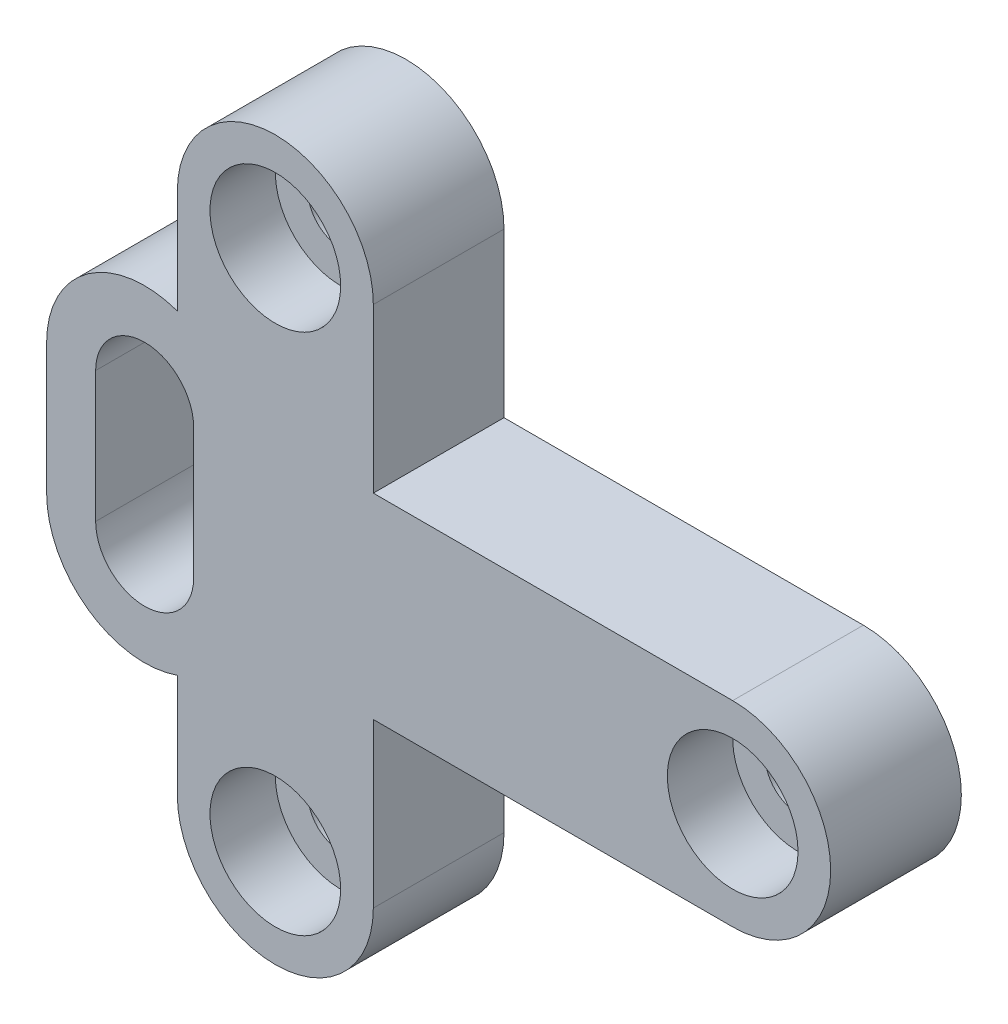
from build123d import *

# Parameters (mm, degrees)
SKETCH1_R           = 5
BOSS_EXTRUDE1_DEPTH = 20
SKETCH2_R           = 10
CUT_EXTRUDE1_DEPTH  = 10


with BuildPart() as part:
    # Sketch1 → Boss-Extrude1 (new body)
    with BuildSketch(Plane.XY):
        with BuildLine():
            Line((-15, 10), (-15, -10))
            ThreePointArc((-15, -10), (-8.660254038, -22.247448714), (5, -24.142135624))
            Line((5, -24.142135624), (5, -40))
            ThreePointArc((5, -40), (20, -55), (35, -40))
            Line((35, -40), (35, -15))
            Line((35, -15), (90, -15))
            ThreePointArc((90, -15), (105, 0), (90, 15))
            Line((90, 15), (35, 15))
            Line((35, 15), (35, 40))
            ThreePointArc((35, 40), (20, 55), (5, 40))
            Line((5, 40), (5, 24.142135624))
            ThreePointArc((5, 24.142135624), (-8.660254038, 22.247448714), (-15, 10))
        make_face()
        with Locations((20, 40)):
            Circle(SKETCH1_R, mode=Mode.SUBTRACT)
        with Locations((20, -40)):
            Circle(SKETCH1_R, mode=Mode.SUBTRACT)
        with Locations((90, 0)):
            Circle(SKETCH1_R, mode=Mode.SUBTRACT)
        with BuildLine():
            Line((7.5, 10), (7.5, -10))
            ThreePointArc((7.5, -10), (0, -17.5), (-7.5, -10))
            Line((-7.5, -10), (-7.5, 10))
            ThreePointArc((-7.5, 10), (0, 17.5), (7.5, 10))
        make_face(mode=Mode.SUBTRACT)
    extrude(amount=BOSS_EXTRUDE1_DEPTH)

    # Sketch2 → Cut-Extrude1 (cut)
    with BuildSketch(Plane.XY.offset(20)):
        with Locations((20, 40)):
            Circle(SKETCH2_R)
        with Locations((20, -40)):
            Circle(SKETCH2_R)
        with Locations((90, 0)):
            Circle(SKETCH2_R)
    extrude(amount=-CUT_EXTRUDE1_DEPTH, mode=Mode.SUBTRACT)


solid = part.part
